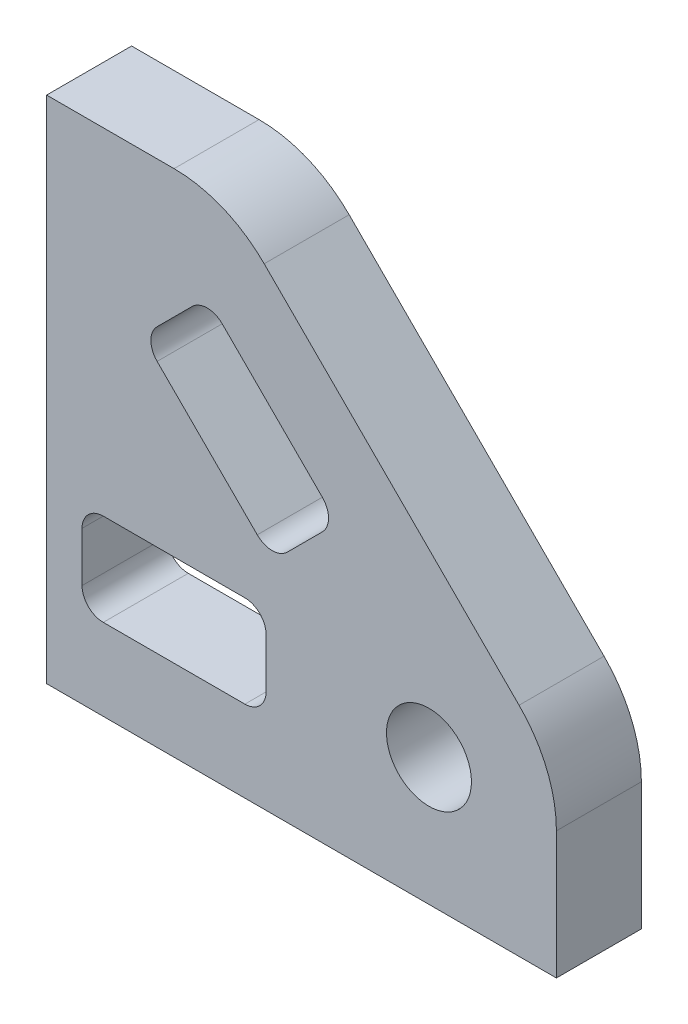
from build123d import *

# Parameters (mm, degrees)
MODEL_R                 = 1.5
SALIENTE_EXTRUIR1_DEPTH = 3


with BuildPart() as part:
    # Model → Saliente-Extruir1 (new body)
    with BuildSketch(Plane.XY):
        with BuildLine():
            Line((180.84213351, 175.823953209), (162.84213351, 175.823953209))
            Line((162.84213351, 175.823953209), (162.84213351, 193.823953209))
            Line((162.84213351, 193.823953209), (167.34213351, 193.823953209))
            ThreePointArc((167.34213351, 193.823953209), (169.064208955, 193.481411105), (170.524114025, 192.505933724))
            Line((170.524114025, 192.505933724), (179.524114025, 183.505933724))
            ThreePointArc((179.524114025, 183.505933724), (180.499591406, 182.046028655), (180.84213351, 180.323953209))
            Line((180.84213351, 180.323953209), (180.84213351, 175.823953209))
        make_face()
        with Locations((176.34213351, 180.323953209)):
            Circle(MODEL_R, mode=Mode.SUBTRACT)
        with BuildLine():
            Line((164.84213351, 181.948953209), (169.84213351, 181.948953209))
            ThreePointArc((169.84213351, 181.948953209), (170.372463595, 181.729283295), (170.59213351, 181.198953209))
            Line((170.59213351, 181.198953209), (170.59213351, 179.448953209))
            ThreePointArc((170.59213351, 179.448953209), (170.372463595, 178.918623123), (169.84213351, 178.698953209))
            Line((169.84213351, 178.698953209), (164.84213351, 178.698953209))
            ThreePointArc((164.84213351, 178.698953209), (164.311803424, 178.918623123), (164.09213351, 179.448953209))
            Line((164.09213351, 179.448953209), (164.09213351, 181.198953209))
            ThreePointArc((164.09213351, 181.198953209), (164.311803424, 181.729283295), (164.84213351, 181.948953209))
        make_face(mode=Mode.SUBTRACT)
        with BuildLine():
            Line((169.041348982, 189.928670304), (172.576882888, 186.393136398))
            ThreePointArc((172.576882888, 186.393136398), (172.796552802, 185.862806312), (172.576882888, 185.332476227))
            Line((172.576882888, 185.332476227), (171.339446021, 184.095039359))
            ThreePointArc((171.339446021, 184.095039359), (170.809115935, 183.875369445), (170.278785849, 184.095039359))
            Line((170.278785849, 184.095039359), (166.743251943, 187.630573265))
            ThreePointArc((166.743251943, 187.630573265), (166.523582029, 188.160903351), (166.743251943, 188.691233437))
            Line((166.743251943, 188.691233437), (167.98068881, 189.928670304))
            ThreePointArc((167.98068881, 189.928670304), (168.511018896, 190.148340218), (169.041348982, 189.928670304))
        make_face(mode=Mode.SUBTRACT)
    extrude(amount=SALIENTE_EXTRUIR1_DEPTH)


solid = part.part
